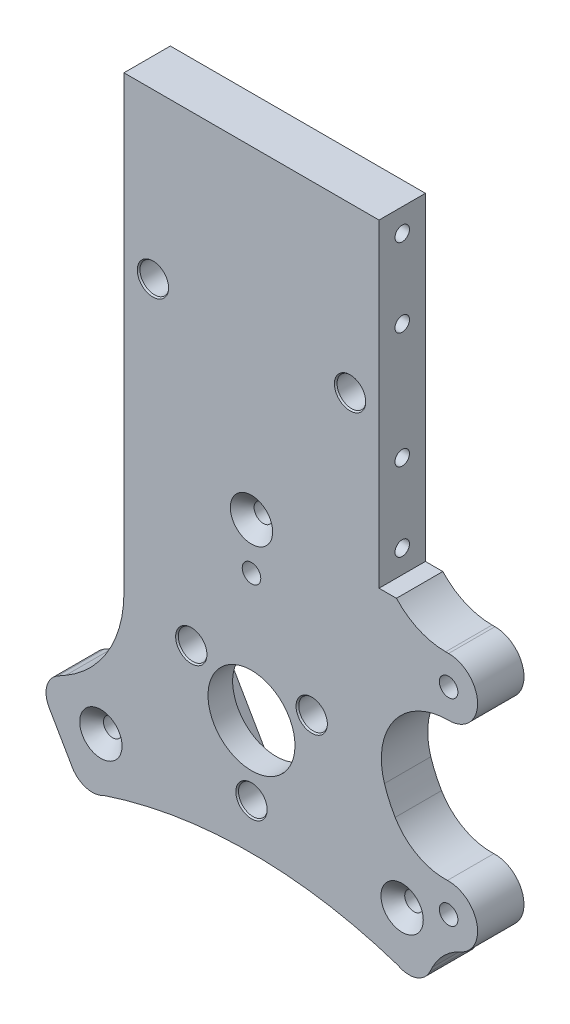
from build123d import *

# Parameters (mm, degrees)
BOSS_EXTRUDE1_DEPTH                             = 8
BOSS_EXTRUDE2_START                             = 3.75
SKETCH1_3_R                                     = 7.5
BOSS_EXTRUDE2_DEPTH                             = 4.25
SKETCH15_W                                      = 44
SKETCH15_H                                      = 8
BOSS_EXTRUDE3_DEPTH                             = 36
SKETCH22_W                                      = 5
SKETCH22_H                                      = 10
CUT_EXTRUDE1_DEPTH                              = 10
CSK_FOR_M3_FLAT_HEAD_MACHINE_SCREW1_D           = 3.2
CSK_FOR_M3_FLAT_HEAD_MACHINE_SCREW1_CSINK_D     = 7.3
CSK_FOR_M3_FLAT_HEAD_MACHINE_SCREW1_CSINK_ANGLE = 90
CBORE_FOR_M3_SBHCS2_AT_2_COUNT                  = 2
CBORE_FOR_M3_SBHCS2_AT_2_PITCH                  = 34
CBORE_FOR_M3_SBHCS2_AT_3_COUNT                  = 2
CBORE_FOR_M3_SBHCS2_AT_3_PITCH                  = 48.083261121
CBORE_FOR_M3_SBHCS2_AT_4_COUNT                  = 2
CBORE_FOR_M3_SBHCS2_AT_4_PITCH                  = 34
CSK_FOR_M4_FLAT_HEAD_MACHINE_SCREW1_D           = 5
CSK_FOR_M4_FLAT_HEAD_MACHINE_SCREW1_CSINK_D     = 5.4
CSK_FOR_M4_FLAT_HEAD_MACHINE_SCREW1_CSINK_ANGLE = 75
FILLET1_R                                       = 10
TAP_DRILL_FOR_M3X0_5_TAP4_AT_2_COUNT            = 2
TAP_DRILL_FOR_M3X0_5_TAP4_AT_2_PITCH            = 13.5
TAP_DRILL_FOR_M3X0_5_TAP4_AT_3_COUNT            = 2
TAP_DRILL_FOR_M3X0_5_TAP4_AT_3_PITCH            = 47
TAP_DRILL_FOR_M3X0_5_TAP4_AT_4_COUNT            = 2
TAP_DRILL_FOR_M3X0_5_TAP4_AT_4_PITCH            = 33.5
CUT_EXTRUDE2_DEPTH                              = 1
CSK_FOR_M4_FLAT_HEAD_MACHINE_SCREW2_D           = 5
CSK_FOR_M4_FLAT_HEAD_MACHINE_SCREW2_CSINK_D     = 5.4
CSK_FOR_M4_FLAT_HEAD_MACHINE_SCREW2_CSINK_ANGLE = 75


with BuildPart() as part:
    # Sketch1 → Boss-Extrude1 (new body)
    with BuildSketch(Plane.XY):
        with BuildLine():
            Line((-34.908965344, -15.535898385), (-30.908965344, -22.464101615))
            ThreePointArc((-30.908965344, -22.464101615), (-28.480139909, -24.32780492), (-25.444863729, -23.92820323))
            ThreePointArc((-25.444863729, -23.92820323), (-0.099802976, -19.807237854), (25.245257776, -23.92820323))
            ThreePointArc((25.245257776, -23.92820323), (28.370669268, -24.230246054), (30.751194283, -22.182679812))
            Line((30.751194283, -22.182679812), (33.327975751, -16.943702652))
            ThreePointArc((33.327975751, -16.943702652), (38.763582033, -10.469765614), (30.583408175, -8.338467401))
            ThreePointArc((30.583408175, -8.338467401), (25.897362485, -3.779012816), (22.93219159, 2.048114425))
            ThreePointArc((22.93219159, 2.048114425), (24.617574432, 12.308222281), (33.890916455, 17.010929616))
            Line((33.890916455, 17.010929616), (34, 17.010929616))
            ThreePointArc((34, 17.010929616), (39.000000252, 22.010929868), (34, 27.01093012))
            Line((34, 27.01093012), (33.494477634, 27.01093012))
            ThreePointArc((33.494477634, 27.01093012), (25.366654553, 30.377584673), (22, 38.505407754))
            Line((22, 38.505407754), (22, 49.757346749))
            Line((22, 49.757346749), (-22, 49.757346749))
            Line((-22, 49.757346749), (-22, 8.082903769))
            ThreePointArc((-22, 8.082903769), (-24.679491924, -1.917096231), (-32, -9.237604307))
            Line((-32, -9.237604307), (-33.444863729, -10.07179677))
            ThreePointArc((-33.444863729, -10.07179677), (-35.308567034, -12.500622204), (-34.908965344, -15.535898385))
        make_face()
        with BuildLine():
            Line((-10.386277084, 10.495620221), (10.386277084, 10.495620221))
            ThreePointArc((10.386277084, 10.495620221), (14.284072501, 8.245422859), (14.284581393, 3.744734354))
            Line((14.284581393, 3.744734354), (3.903550031, -14.242001198))
            ThreePointArc((3.903550031, -14.242001198), (3.3459e-05, -16.496109207), (-3.90351658, -14.242059155))
            Line((-3.90351658, -14.242059155), (-14.284726037, 3.744368131))
            ThreePointArc((-14.284726037, 3.744368131), (-14.284267239, 8.245291146), (-10.386277084, 10.495620221))
        make_face(mode=Mode.SUBTRACT)
    extrude(amount=BOSS_EXTRUDE1_DEPTH)

    # Sketch1<3> → Boss-Extrude2 (add)
    with BuildSketch(Plane.XY.offset(BOSS_EXTRUDE2_START)):
        with BuildLine():
            ThreePointArc((14.284581393, 3.744734354), (14.284072501, 8.245422859), (10.386277084, 10.495620221))
            Line((10.386277084, 10.495620221), (-10.386277084, 10.495620221))
            ThreePointArc((-10.386277084, 10.495620221), (-14.284267239, 8.245291146), (-14.284726037, 3.744368131))
            Line((-14.284726037, 3.744368131), (-12.092701093, -0.053522416))
            Line((-12.092701093, -0.053522416), (-3.90351658, -14.242059155))
            ThreePointArc((-3.90351658, -14.242059155), (3.3459e-05, -16.496109207), (3.903550031, -14.242001198))
            Line((3.903550031, -14.242001198), (14.284581393, 3.744734354))
        make_face()
        Circle(SKETCH1_3_R, mode=Mode.SUBTRACT)
    extrude(amount=BOSS_EXTRUDE2_DEPTH)

    # Sketch15 → Boss-Extrude3 (add)
    with BuildSketch(Plane(origin=(0, 49.757346749, 0), x_dir=(1, 0, 0), z_dir=(0, 1, 0))):
        with Locations((0, -4)):
            Rectangle(SKETCH15_W, SKETCH15_H)
    extrude(amount=BOSS_EXTRUDE3_DEPTH)

    # Sketch4 → Cut-Revolve1 (revolve, cut)
    with BuildSketch(Plane(origin=(0, 0, 0), x_dir=(-1, 0, 0), z_dir=(0, 0, -1))):
        with BuildLine():
            Line((0, 26), (0, 34))
            ThreePointArc((0, 34), (4, 30), (0, 26))
        make_face()
    revolve(axis=Axis((0, 26, 0), (0, 1, 0)), mode=Mode.SUBTRACT)

    # Sketch22 → Cut-Extrude1 (cut)
    with BuildSketch(Plane.XY.offset(8)):
        with Locations((24.5, 35.757346749)):
            Rectangle(SKETCH22_W, SKETCH22_H)
    extrude(amount=-CUT_EXTRUDE1_DEPTH, mode=Mode.SUBTRACT)

    # Sketch5 → Cut-Revolve2 (revolve, cut)
    with BuildSketch(Plane(origin=(0, 0, 0), x_dir=(-1, 0, 0), z_dir=(0, 0, -1))):
        with BuildLine():
            Line((-22.516660498, -13), (-29.444863729, -17))
            ThreePointArc((-29.444863729, -17), (-27.980762114, -11.535898385), (-22.516660498, -13))
        make_face()
    revolve(axis=Axis((22.516660498, -13, 0), (0.8660254037844364, -0.5000000000000041, 0)), mode=Mode.SUBTRACT)

    # Sketch6 → Cut-Revolve3 (revolve, cut)
    with BuildSketch(Plane(origin=(0, 0, 0), x_dir=(-1, 0, 0), z_dir=(0, 0, -1))):
        with BuildLine():
            Line((22.516660498, -13), (29.444863729, -17))
            ThreePointArc((29.444863729, -17), (23.980762114, -18.464101615), (22.516660498, -13))
        make_face()
    revolve(axis=Axis((-22.516660498, -13, 0), (-0.8660254037844433, -0.49999999999999206, 0)), mode=Mode.SUBTRACT)

    # CSK for M3 Flat Head Machine Screw1 (through all)
    with Locations(Plane.XY.offset(8)):
        with Locations((0, 30), (25.980762114, -15), (-25.980762114, -15)):
            CounterSinkHole(CSK_FOR_M3_FLAT_HEAD_MACHINE_SCREW1_D / 2, CSK_FOR_M3_FLAT_HEAD_MACHINE_SCREW1_CSINK_D / 2, counter_sink_angle=CSK_FOR_M3_FLAT_HEAD_MACHINE_SCREW1_CSINK_ANGLE)

    # Sketch12 → CBORE for M3 SBHCS2 (revolve, cut)
    with BuildSketch(Plane(origin=(34, 22.010929787, 0), x_dir=(0, 1, 0), z_dir=(1, 0, 0))):
        Polygon((0, 0), (0, 8), (1.6, 8), (1.6, 3), (3.35, 3), (3.35, 0.025), (3.375, 0), align=None)
    cbore_for_m3_sbhcs2 = revolve(axis=Axis((34, 22.010929787, -6.35), (0, 0, 1)), mode=Mode.SUBTRACT)

    # CBORE for M3 SBHCS2 at 2: CBORE for M3 SBHCS2 ×2
    with Locations(*[(-i * CBORE_FOR_M3_SBHCS2_AT_2_PITCH, 0, 0) for i in range(1, CBORE_FOR_M3_SBHCS2_AT_2_COUNT)]):
        add(cbore_for_m3_sbhcs2, mode=Mode.SUBTRACT)

    # CBORE for M3 SBHCS2 at 3: CBORE for M3 SBHCS2 ×2
    with Locations(*[Vector(-0.7071067811865438, -0.7071067811865512, 0) * (i * CBORE_FOR_M3_SBHCS2_AT_3_PITCH) for i in range(1, CBORE_FOR_M3_SBHCS2_AT_3_COUNT)]):
        add(cbore_for_m3_sbhcs2, mode=Mode.SUBTRACT)

    # CBORE for M3 SBHCS2 at 4: CBORE for M3 SBHCS2 ×2
    with Locations(*[(0, -i * CBORE_FOR_M3_SBHCS2_AT_4_PITCH, 0) for i in range(1, CBORE_FOR_M3_SBHCS2_AT_4_COUNT)]):
        add(cbore_for_m3_sbhcs2, mode=Mode.SUBTRACT)

    # CSK for M4 Flat Head Machine Screw1 (through all)
    with Locations(Plane.XY.offset(8)):
        with Locations((-10.386277084, 5.994432277), (10.386277084, 5.994637855), (0, -11.989070132)):
            CounterSinkHole(CSK_FOR_M4_FLAT_HEAD_MACHINE_SCREW1_D / 2, CSK_FOR_M4_FLAT_HEAD_MACHINE_SCREW1_CSINK_D / 2, counter_sink_angle=CSK_FOR_M4_FLAT_HEAD_MACHINE_SCREW1_CSINK_ANGLE)

    # Fillet1
    fillet1_edges = [part.edges().sort_by_distance(p)[0] for p in [
        (30.583408175, -8.338467401, 4),
        (33.327975751, -16.943702652, 4),
    ]]
    fillet(fillet1_edges, radius=FILLET1_R)

    # Sketch26 → Tap Drill for M3x0.5 Tap4 (revolve, cut)
    with BuildSketch(Plane(origin=(22, 81.757346749, 4), x_dir=(0, 0, -1), z_dir=(0, 1, 0))):
        Polygon((0, 0), (0, 5.751075774), (1.25, 5), (1.25, 0), align=None)
    tap_drill_for_m3x0_5_tap4 = revolve(axis=Axis((28.35, 81.757346749, 4), (-1, 0, 0)), mode=Mode.SUBTRACT)

    # Tap Drill for M3x0.5 Tap4 at 2: Tap Drill for M3x0.5 Tap4 ×2
    with Locations(*[(0, -i * TAP_DRILL_FOR_M3X0_5_TAP4_AT_2_PITCH, 0) for i in range(1, TAP_DRILL_FOR_M3X0_5_TAP4_AT_2_COUNT)]):
        add(tap_drill_for_m3x0_5_tap4, mode=Mode.SUBTRACT)

    # Tap Drill for M3x0.5 Tap4 at 3: Tap Drill for M3x0.5 Tap4 ×2
    with Locations(*[(0, -i * TAP_DRILL_FOR_M3X0_5_TAP4_AT_3_PITCH, 0) for i in range(1, TAP_DRILL_FOR_M3X0_5_TAP4_AT_3_COUNT)]):
        add(tap_drill_for_m3x0_5_tap4, mode=Mode.SUBTRACT)

    # Tap Drill for M3x0.5 Tap4 at 4: Tap Drill for M3x0.5 Tap4 ×2
    with Locations(*[(0, -i * TAP_DRILL_FOR_M3X0_5_TAP4_AT_4_PITCH, 0) for i in range(1, TAP_DRILL_FOR_M3X0_5_TAP4_AT_4_COUNT)]):
        add(tap_drill_for_m3x0_5_tap4, mode=Mode.SUBTRACT)

    # Mirror1: Tap Drill for M3x0.5 Tap4 across plane
    add(tap_drill_for_m3x0_5_tap4.mirror(Plane(origin=(0, 0, 0), x_dir=(0, 0, 1), z_dir=(1, 0, 0))), mode=Mode.SUBTRACT)

    # Mirror1 copy 1 sketch → Mirror1 copy 1 (revolve, cut)
    with BuildSketch(Plane(origin=(-22, 68.257346749, 4), x_dir=(0, 0, -1), z_dir=(0, 1, 0))):
        Polygon((0, 0), (0, -5.751075774), (1.25, -5), (1.25, 0), align=None)
    revolve(axis=Axis((-28.35, 68.257346749, 4), (-1, 0, 0)), mode=Mode.SUBTRACT)

    # Mirror1 copy 2 sketch → Mirror1 copy 2 (revolve, cut)
    with BuildSketch(Plane(origin=(-22, 34.757346749, 4), x_dir=(0, 0, -1), z_dir=(0, 1, 0))):
        Polygon((0, 0), (0, -5.751075774), (1.25, -5), (1.25, 0), align=None)
    revolve(axis=Axis((-28.35, 34.757346749, 4), (-1, 0, 0)), mode=Mode.SUBTRACT)

    # Mirror1 copy 3 sketch → Mirror1 copy 3 (revolve, cut)
    with BuildSketch(Plane(origin=(-22, 48.257346749, 4), x_dir=(0, 0, -1), z_dir=(0, 1, 0))):
        Polygon((0, 0), (0, -5.751075774), (1.25, -5), (1.25, 0), align=None)
    revolve(axis=Axis((-28.35, 48.257346749, 4), (-1, 0, 0)), mode=Mode.SUBTRACT)

    # Sketch27 → Cut-Extrude2 (cut)
    # profile 1 of 6: a face of its own
    with BuildSketch(Plane(origin=(0, 0, 0), x_dir=(-1, 0, 0), z_dir=(0, 0, -1))):
        Polygon((-19.567307692, 78.089783713), (-18.221153846, 78.089783713), (-18.221153846, 75.205168328), (-15.625, 75.205168328), (-15.625, 78.089783713), (-14.278846154, 78.089783713), (-14.278846154, 70.589783713), (-15.625, 70.589783713), (-15.625, 73.859014482), (-18.221153846, 73.859014482), (-18.221153846, 70.589783713), (-19.567307692, 70.589783713), align=None)
    # profile 2 of 6: a face of its own
    with BuildSketch(Plane(origin=(0, 0, 0), x_dir=(-1, 0, 0), z_dir=(0, 0, -1))):
        Polygon((-12.548076923, 78.089783713), (-8.509615385, 78.089783713), (-8.509615385, 76.743629867), (-11.201923077, 76.743629867), (-11.201923077, 75.301322174), (-8.509615385, 75.301322174), (-8.509615385, 73.955168328), (-11.201923077, 73.955168328), (-11.201923077, 71.935937559), (-8.509615385, 71.935937559), (-8.509615385, 70.589783713), (-12.548076923, 70.589783713), align=None)
    # profile 3 of 6: a face of its own
    with BuildSketch(Plane(origin=(0, 0, 0), x_dir=(-1, 0, 0), z_dir=(0, 0, -1))):
        Polygon((-6.570012019, 78.089783713), (-5.172776442, 78.089783713), (-3.461538462, 72.858413521), (-1.73828125, 78.089783713), (-0.354567308, 78.089783713), (0.913461538, 70.589783713), (-0.44921875, 70.589783713), (-1.25, 75.32686304), (-2.809495192, 70.589783713), (-4.122596154, 70.589783713), (-5.673076923, 75.32686304), (-6.472355769, 70.589783713), (-7.836538462, 70.589783713), align=None)
    # profile 4 of 6: a face of its own
    with BuildSketch(Plane(origin=(0, 0, 0), x_dir=(-1, 0, 0), z_dir=(0, 0, -1))):
        Polygon((2.163461538, 78.089783713), (6.201923077, 78.089783713), (6.201923077, 76.743629867), (3.509615385, 76.743629867), (3.509615385, 75.301322174), (6.201923077, 75.301322174), (6.201923077, 73.955168328), (3.509615385, 73.955168328), (3.509615385, 71.935937559), (6.201923077, 71.935937559), (6.201923077, 70.589783713), (2.163461538, 70.589783713), align=None)
    # profile 5 of 6: a face of its own
    with BuildSketch(Plane(origin=(0, 0, 0), x_dir=(-1, 0, 0), z_dir=(0, 0, -1))):
        with BuildLine():
            Line((7.548076923, 78.089783713), (9.116586538, 78.089783713))
            add(Edge.make_bspline(
                [(9.116586538, 78.089783713), (9.220264547, 78.089415715), (9.419666561, 78.088707953), (9.707193374, 78.077541332), (9.971326293, 78.062002063), (10.212456392, 78.038288725), (10.430480509, 78.006847706), (10.625617157, 77.969783947), (10.797860632, 77.927541848), (10.94866357, 77.874904859), (11.084755764, 77.815531134), (11.211612609, 77.747309635), (11.332032756, 77.671000031), (11.445211326, 77.584594408), (11.552131869, 77.489647183), (11.652996094, 77.386062782), (11.746378699, 77.272962853), (11.831701453, 77.151062042), (11.909466275, 77.022825185), (11.978194068, 76.88807621), (12.034083624, 76.74672141), (12.083468037, 76.600803667), (12.119038031, 76.448237058), (12.14377644, 76.290506844), (12.161888936, 76.127057799), (12.162930318, 76.016017774), (12.163461538, 75.959375059)],
                knots=[0, 0, 0, 0, 1.749336639, 3.364467119, 4.854658419, 6.213483162, 7.451590619, 8.570285859, 9.5643256, 10.440900261, 11.26203566, 12.067320669, 12.869050712, 13.665104639, 14.467235401, 15.27997916, 16.102287765, 16.939272006, 17.78853747, 18.631303466, 19.488103222, 20.351255419, 21.228522269, 22.127379805, 23.044756219, 24, 24, 24, 24], degree=3))
            add(Edge.make_bspline(
                [(12.163461538, 75.959375059), (12.16208162, 75.900253076), (12.15937585, 75.784325644), (12.144801103, 75.6140377), (12.118163044, 75.451118107), (12.077815829, 75.296043873), (12.031441945, 75.146884918), (11.969776575, 75.006393318), (11.900181111, 74.872525826), (11.817524611, 74.747176049), (11.726813141, 74.627559718), (11.621317609, 74.518259778), (11.507872506, 74.413401772), (11.380100669, 74.319553648), (11.243634399, 74.230369737), (11.095762255, 74.149545363), (10.937449302, 74.075048787), (10.826147455, 74.03350435), (10.769230769, 74.012259674)],
                knots=[0, 0, 0, 0, 1.099860209, 2.156625411, 3.176576793, 4.16617041, 5.135385252, 6.078461593, 7.016046972, 7.938469504, 8.868247731, 9.803980173, 10.76021508, 11.73834243, 12.748633912, 13.790971185, 14.870363756, 16, 16, 16, 16], degree=3))
            Line((10.769230769, 74.012259674), (12.5, 70.589783713))
            Line((12.5, 70.589783713), (11.003605769, 70.589783713))
            Line((11.003605769, 70.589783713), (9.350961538, 73.859014482))
            Line((9.350961538, 73.859014482), (8.894230769, 73.859014482))
            Line((8.894230769, 73.859014482), (8.894230769, 70.589783713))
            Line((8.894230769, 70.589783713), (7.548076923, 70.589783713))
            Line((7.548076923, 70.589783713), (7.548076923, 78.089783713))
        make_face()
        with BuildLine():
            Line((8.894230769, 75.205168328), (9.418569712, 75.205168328))
            add(Edge.make_bspline(
                [(9.418569712, 75.205168328), (9.482674506, 75.20589032), (9.605421412, 75.207272778), (9.781947586, 75.213685192), (9.942275451, 75.229135941), (10.087093509, 75.248657385), (10.217130471, 75.271197711), (10.331226454, 75.303499367), (10.431139503, 75.33811141), (10.515685645, 75.3811252), (10.587919925, 75.430041208), (10.650289603, 75.48561101), (10.701878269, 75.54992598), (10.744338373, 75.621238314), (10.777367717, 75.700178753), (10.801476609, 75.785880709), (10.814949913, 75.879320438), (10.816500063, 75.943806574), (10.817307692, 75.977403905)],
                knots=[0, 0, 0, 0, 1.688639943, 3.233382647, 4.650958383, 5.928841754, 7.082724185, 8.122798841, 9.049171256, 9.863274652, 10.613301712, 11.341792392, 12.054588806, 12.776240173, 13.521029143, 14.301969904, 15.115324896, 16, 16, 16, 16], degree=3))
            add(Edge.make_bspline(
                [(10.817307692, 75.977403905), (10.815780795, 76.017152), (10.812781489, 76.095229768), (10.783019051, 76.207634376), (10.73564368, 76.311672531), (10.670705021, 76.406874163), (10.588923224, 76.490334485), (10.495072158, 76.563905424), (10.387126293, 76.622079818), (10.287176545, 76.660451029), (10.196245636, 76.68340892), (10.11418336, 76.700516938), (10.01915475, 76.712641881), (9.911088065, 76.725502541), (9.790258771, 76.733842028), (9.656008275, 76.739928192), (9.508722145, 76.74241834), (9.406049723, 76.743214397), (9.352463942, 76.743629867)],
                knots=[0, 0, 0, 0, 1.020303359, 2.004196876, 2.966617323, 3.9489082, 4.950758222, 5.960522915, 7.003732012, 8.091992268, 8.70421221, 9.413913587, 10.24622431, 11.166358409, 12.212345909, 13.359657661, 14.621978493, 16, 16, 16, 16], degree=3))
            Line((9.352463942, 76.743629867), (8.894230769, 76.743629867))
            Line((8.894230769, 76.743629867), (8.894230769, 75.205168328))
        make_face(mode=Mode.SUBTRACT)
    # profile 6 of 6: a face of its own
    with BuildSketch(Plane(origin=(0, 0, 0), x_dir=(-1, 0, 0), z_dir=(0, 0, -1))):
        Polygon((15.914963942, 78.089783713), (17.163461538, 78.089783713), (20.192307692, 70.589783713), (18.754507212, 70.589783713), (18.171574519, 72.128245251), (14.903846154, 72.128245251), (14.320913462, 70.589783713), (12.884615385, 70.589783713), align=None)
        Polygon((16.538461538, 76.078064963), (15.414663462, 73.474399097), (17.662259615, 73.474399097), align=None, mode=Mode.SUBTRACT)
    extrude(amount=-CUT_EXTRUDE2_DEPTH, mode=Mode.SUBTRACT)

    # CSK for M4 Flat Head Machine Screw2 (through all)
    with Locations(Plane.XY.offset(8)):
        with Locations((-16.999999999, 57.455082436), (17.000000001, 57.455082436)):
            CounterSinkHole(CSK_FOR_M4_FLAT_HEAD_MACHINE_SCREW2_D / 2, CSK_FOR_M4_FLAT_HEAD_MACHINE_SCREW2_CSINK_D / 2, counter_sink_angle=CSK_FOR_M4_FLAT_HEAD_MACHINE_SCREW2_CSINK_ANGLE)


solid = part.part
